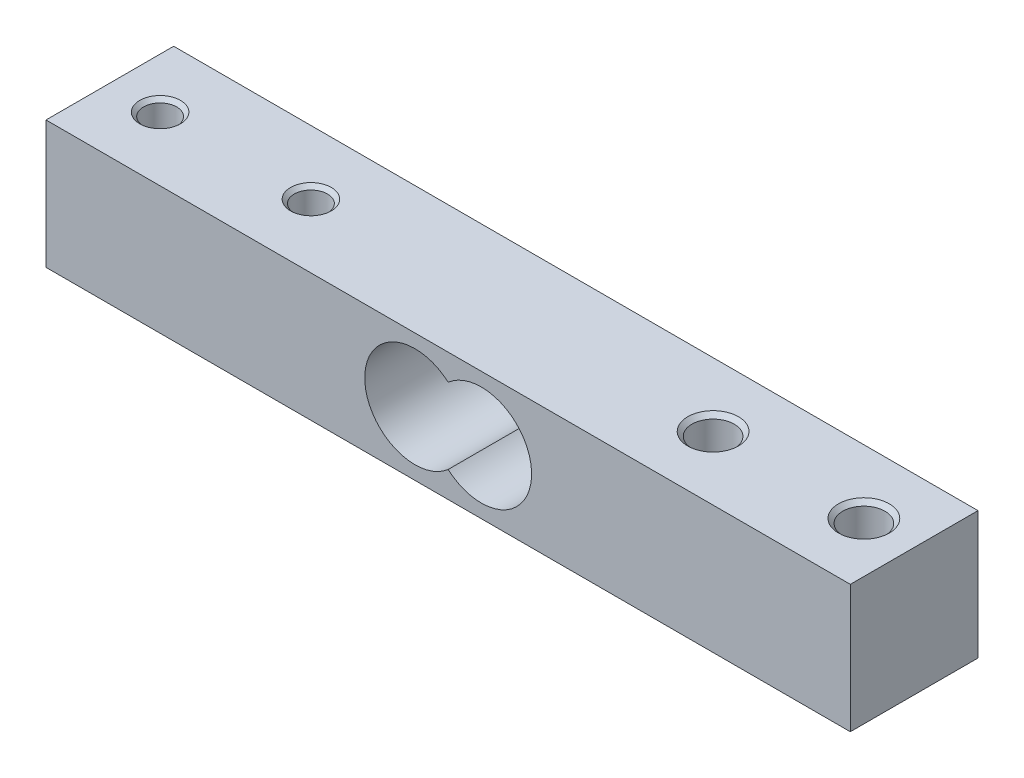
from build123d import *

# Parameters (mm, degrees)
SKETCH1_W                   = 80
SKETCH1_H                   = 12.7
BOSS_EXTRUDE1_DEPTH         = 12.7
CUT_EXTRUDE1_DEPTH          = 44.847234804
M4_TAPPED_HOLE2_D           = 3.3
M4_TAPPED_HOLE2_CSINK_D     = 4.05
M4_TAPPED_HOLE2_CSINK_ANGLE = 90
M5_TAPPED_HOLE1_D           = 4.2
M5_TAPPED_HOLE1_CSINK_D     = 5.05
M5_TAPPED_HOLE1_CSINK_ANGLE = 90


with BuildPart() as part:
    # Sketch1 → Boss-Extrude1 (new body)
    with BuildSketch(Plane(origin=(0, 0, 0), x_dir=(1, 0, 0), z_dir=(0, 1, 0))):
        Rectangle(SKETCH1_W, SKETCH1_H)
    extrude(amount=BOSS_EXTRUDE1_DEPTH)

    # Sketch4 → Cut-Extrude1 (cut, through all)
    with BuildSketch(Plane.XY.offset(6.35)):
        with BuildLine():
            ThreePointArc((0, 2.593672006), (8.3, 6.35), (0, 10.106327994))
            ThreePointArc((0, 10.106327994), (-8.3, 6.35), (0, 2.593672006))
        make_face()
    extrude(amount=-CUT_EXTRUDE1_DEPTH, mode=Mode.SUBTRACT)

    # M4 Tapped Hole2 (through all)
    with Locations(Plane(origin=(0, 12.7, 0), x_dir=(1, 0, 0), z_dir=(0, 1, 0))):
        with Locations((-35, 0), (-20, 0)):
            CounterSinkHole(M4_TAPPED_HOLE2_D / 2, M4_TAPPED_HOLE2_CSINK_D / 2, counter_sink_angle=M4_TAPPED_HOLE2_CSINK_ANGLE)

    # M5 Tapped Hole1 (through all)
    with Locations(Plane(origin=(0, 12.7, 0), x_dir=(1, 0, 0), z_dir=(0, 1, 0))):
        with Locations((35, 0), (20, 0)):
            CounterSinkHole(M5_TAPPED_HOLE1_D / 2, M5_TAPPED_HOLE1_CSINK_D / 2, counter_sink_angle=M5_TAPPED_HOLE1_CSINK_ANGLE)


solid = part.part
